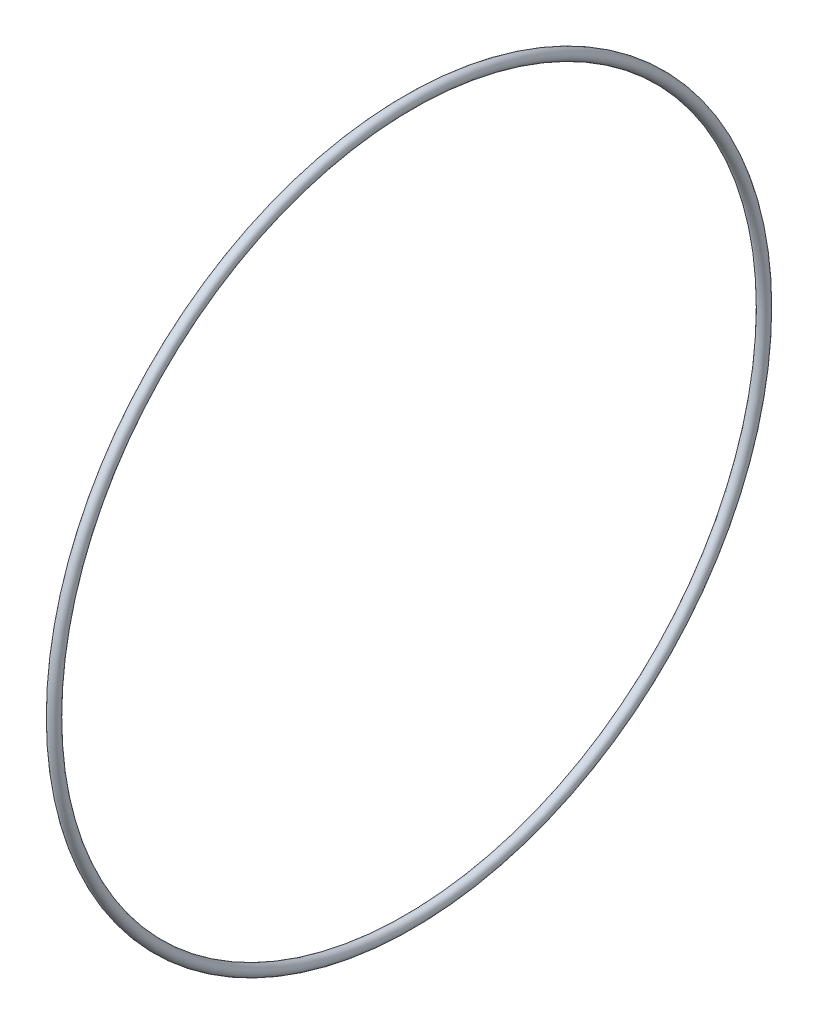
from build123d import *

# Parameters (mm, degrees)
CROQUIS1_R = 0.25


with BuildPart() as part:
    # Croquis1 → Revolución1 (revolve)
    with BuildSketch(Plane(origin=(0, 0, 0), x_dir=(1, 0, 0), z_dir=(0, 1, 0)), mode=Mode.PRIVATE) as revoluci_n1_sk:
        with Locations((0, 16.25)):
            Circle(CROQUIS1_R)
    revolve(revoluci_n1_sk.sketch.rotate(Axis((0, 0, 0), (1, 0, 0)), 180), axis=Axis((0, 0, 0), (1, 0, 0)))


solid = part.part
